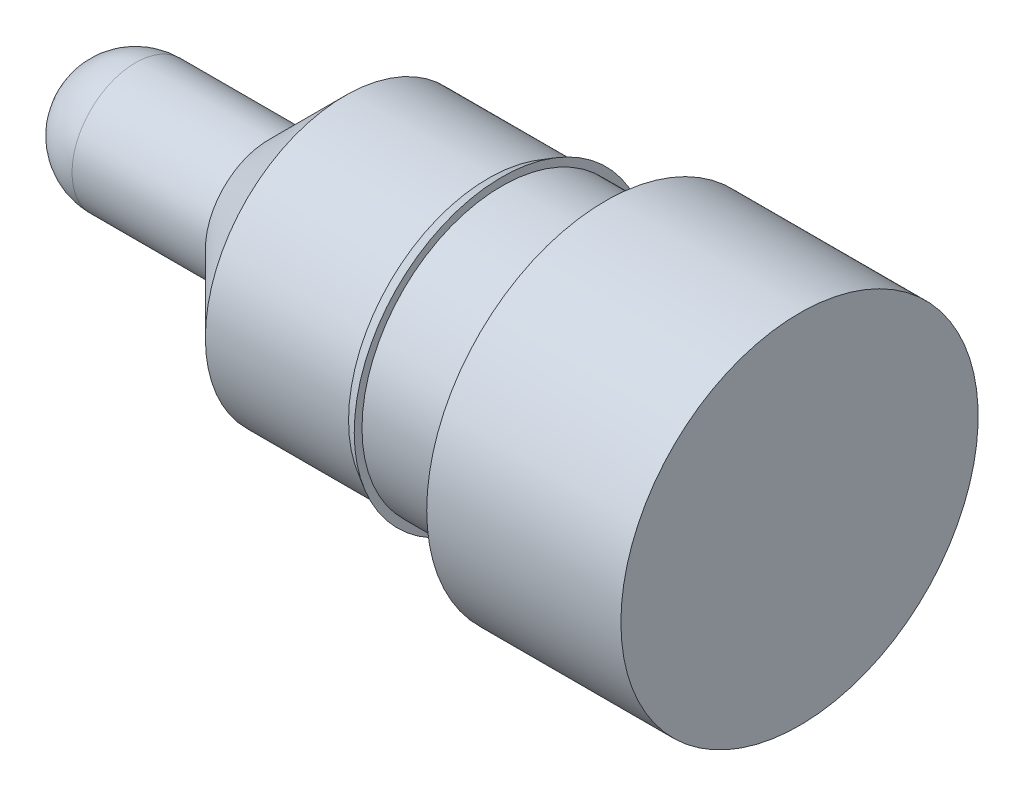
from build123d import *


with BuildPart() as part:
    # Sketch1 → Revolve1 (revolve)
    with BuildSketch(Plane.XY, mode=Mode.PRIVATE) as revolve1_sk:
        Polygon((0, 0), (0, 0.6223), (1.9304, 0.6223), (2.6797, 1.3716), (4.084417728, 1.3716), (4.2164, 1.4478), (4.2164, 1.3716), (5.2324, 1.3716), (5.2324, 1.7526), (7.1374, 1.7526), (7.1374, 0), align=None)
    revolve(revolve1_sk.sketch.rotate(Axis((-2.173675745, 0, 0), (1, 0, 0)), 90), axis=Axis((-2.173675745, 0, 0), (1, 0, 0)))

    # Sketch2 → Cut-Revolve1 (revolve, cut)
    with BuildSketch(Plane.XY, mode=Mode.PRIVATE) as cut_revolve1_sk:
        with BuildLine():
            Line((0.6223, 0.6223), (-0.23767542, 0.6223))
            Line((-0.23767542, 0.6223), (-0.23767542, 0))
            Line((-0.23767542, 0), (0, 0))
            ThreePointArc((0, 0), (0.18226745, 0.44003255), (0.6223, 0.6223))
        make_face()
    revolve(cut_revolve1_sk.sketch.rotate(Axis((-2.173675745, 0, 0), (1, 0, 0)), 90), axis=Axis((-2.173675745, 0, 0), (1, 0, 0)), mode=Mode.SUBTRACT)


solid = part.part
